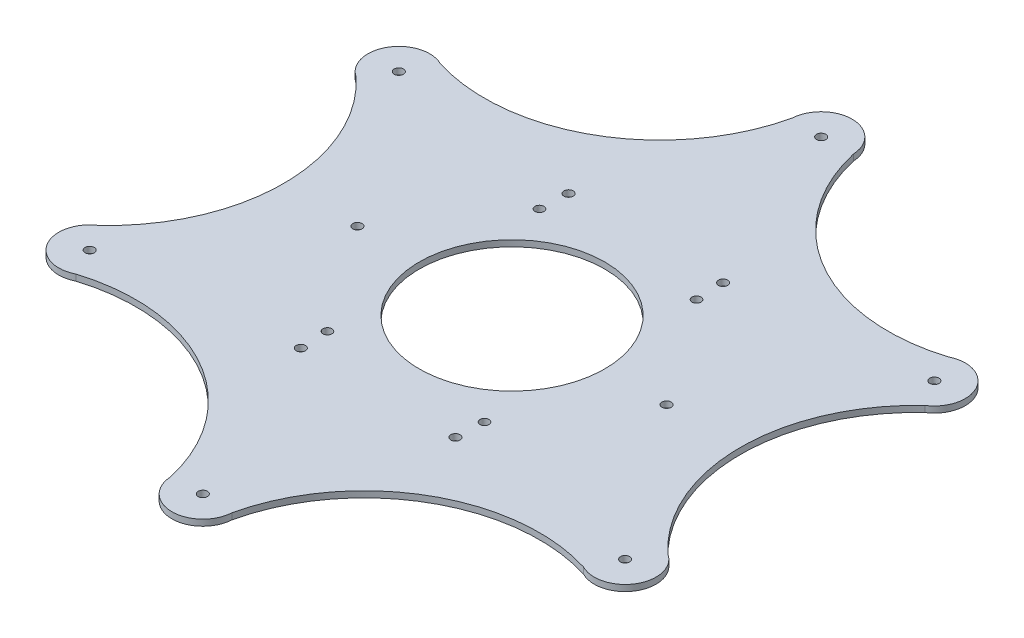
from build123d import *

# Parameters (mm, degrees)
SKETCH1_R           = 1.5
BOSS_EXTRUDE1_DEPTH = 2
SKETCH3_R           = 30
CUT_EXTRUDE1_DEPTH  = 147.410555656
M3_5_TAPPED_HOLE1_D = 2.9


with BuildPart() as part:
    # Sketch1 → Boss-Extrude1 (new body)
    with BuildSketch(Plane(origin=(0, 0, 0), x_dir=(1, 0, 0), z_dir=(0, 1, 0))):
        with BuildLine():
            ThreePointArc((-92.04043234, 41.60778152), (-73.883899315, -0.003033538), (-92.04602482, -41.611407917))
            ThreePointArc((-92.04602482, -41.611407917), (-95.261127604, -55.002885894), (-82.053611962, -58.905461822))
            ThreePointArc((-82.053611962, -58.905461822), (-36.939322536, -63.986850506), (-9.986476067, -100.51989977))
            ThreePointArc((-9.986476067, -100.51989977), (0.003332664, -109.999999445), (9.986820378, -100.513243342))
            ThreePointArc((9.986820378, -100.513243342), (36.944576778, -63.983816968), (82.059548754, -58.908491853))
            ThreePointArc((82.059548754, -58.908491853), (95.264460267, -54.997113551), (92.04043234, -41.60778152))
            ThreePointArc((92.04043234, -41.60778152), (73.883899315, 0.003033538), (92.04602482, 41.611407917))
            ThreePointArc((92.04602482, 41.611407917), (95.261127604, 55.002885894), (82.053611962, 58.905461822))
            ThreePointArc((82.053611962, 58.905461822), (36.939322536, 63.986850506), (9.986476067, 100.51989977))
            ThreePointArc((9.986476067, 100.51989977), (-0.003332664, 109.999999445), (-9.986820378, 100.513243342))
            ThreePointArc((-9.986820378, 100.513243342), (-36.944576778, 63.983816968), (-82.059548754, 58.908491853))
            ThreePointArc((-82.059548754, 58.908491853), (-95.264460267, 54.997113551), (-92.04043234, 41.60778152))
        make_face()
        with Locations(Location((86.602540378, 50, 0), (0, 0, 90))):
            Circle(SKETCH1_R, mode=Mode.SUBTRACT)
        with Locations(Location((86.602540378, -50, 0), (0, 0, 90))):
            Circle(SKETCH1_R, mode=Mode.SUBTRACT)
        with Locations(Location((0, -100, 0), (0, 0, 90))):
            Circle(SKETCH1_R, mode=Mode.SUBTRACT)
        with Locations(Location((-86.602540378, -50, 0), (0, 0, 90))):
            Circle(SKETCH1_R, mode=Mode.SUBTRACT)
        with Locations(Location((-86.602540378, 50, 0), (0, 0, 90))):
            Circle(SKETCH1_R, mode=Mode.SUBTRACT)
        with Locations(Location((0, 100, 0), (0, 0, 90))):
            Circle(SKETCH1_R, mode=Mode.SUBTRACT)
        with Locations(Location((-25, 43.301270189, 0), (0, 0, 90))):
            Circle(SKETCH1_R, mode=Mode.SUBTRACT)
        with Locations(Location((25, 43.301270189, 0), (0, 0, 90))):
            Circle(SKETCH1_R, mode=Mode.SUBTRACT)
        with Locations(Location((50, 0, 0), (0, 0, 90))):
            Circle(SKETCH1_R, mode=Mode.SUBTRACT)
        with Locations(Location((25, -43.301270189, 0), (0, 0, 90))):
            Circle(SKETCH1_R, mode=Mode.SUBTRACT)
        with Locations(Location((-50, 0, 0), (0, 0, 90))):
            Circle(SKETCH1_R, mode=Mode.SUBTRACT)
        with Locations(Location((-25, -43.301270189, 0), (0, 0, 90))):
            Circle(SKETCH1_R, mode=Mode.SUBTRACT)
    extrude(amount=BOSS_EXTRUDE1_DEPTH)

    # Sketch3 → Cut-Extrude1 (cut, through all)
    with BuildSketch(Plane(origin=(0, 0, 0), x_dir=(-1, 0, 0), z_dir=(0, -1, 0))):
        with Locations(Location((0, 0, 0), (0, 0, 90))):
            Circle(SKETCH3_R)
    extrude(amount=-CUT_EXTRUDE1_DEPTH, mode=Mode.SUBTRACT)

    # M3.5 Tapped Hole1 (through all)
    with Locations(Plane(origin=(-25.4, 2, -34.29), x_dir=(0, 0, 1), z_dir=(0, 1, 0))):
        with Locations((0, 0), (0, 50.8), (68.58, 50.8), (68.58, 0)):
            Hole(M3_5_TAPPED_HOLE1_D / 2)


solid = part.part
